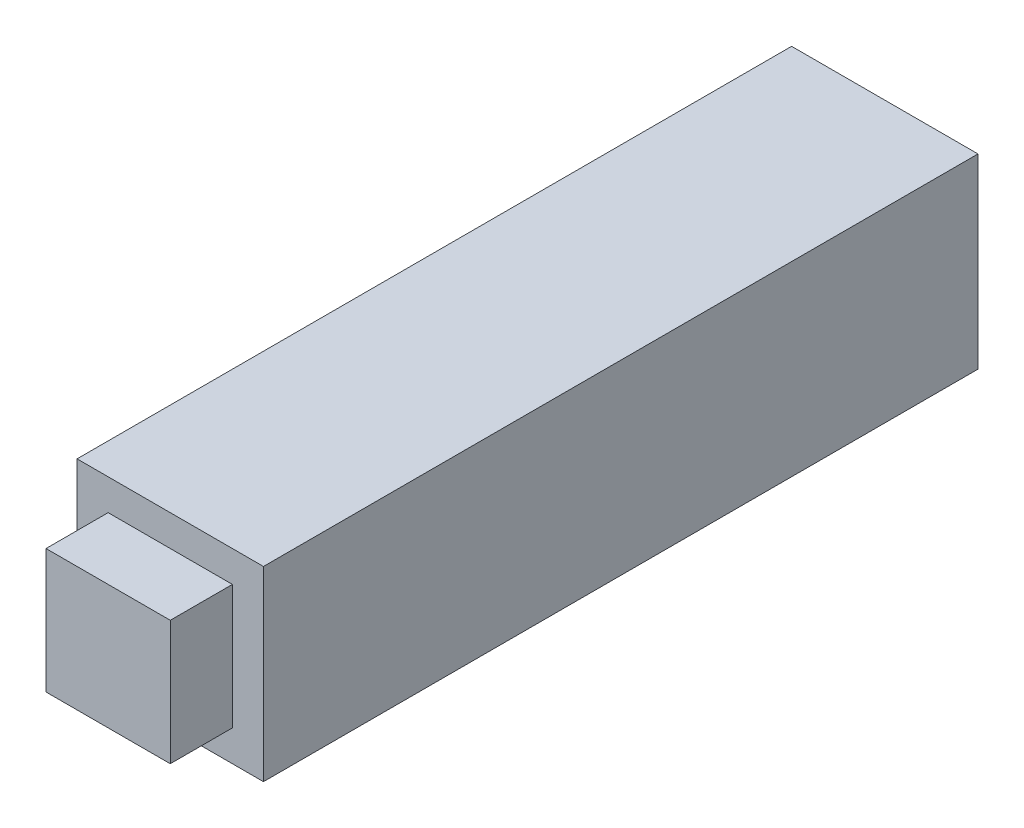
from build123d import *

# Parameters (mm, degrees)
SKETCH1_W           = 30
SKETCH1_H           = 30
BOSS_EXTRUDE1_DEPTH = 115
SKETCH2_W           = 20
SKETCH2_H           = 20
BOSS_EXTRUDE2_DEPTH = 10


with BuildPart() as part:
    # Sketch1 → Boss-Extrude1 (new body)
    with BuildSketch(Plane.XY):
        Rectangle(SKETCH1_W, SKETCH1_H)
    extrude(amount=BOSS_EXTRUDE1_DEPTH)

    # Sketch2 → Boss-Extrude2 (add)
    with BuildSketch(Plane.XY.offset(115)):
        Rectangle(SKETCH2_W, SKETCH2_H)
    extrude(amount=BOSS_EXTRUDE2_DEPTH)


solid = part.part
